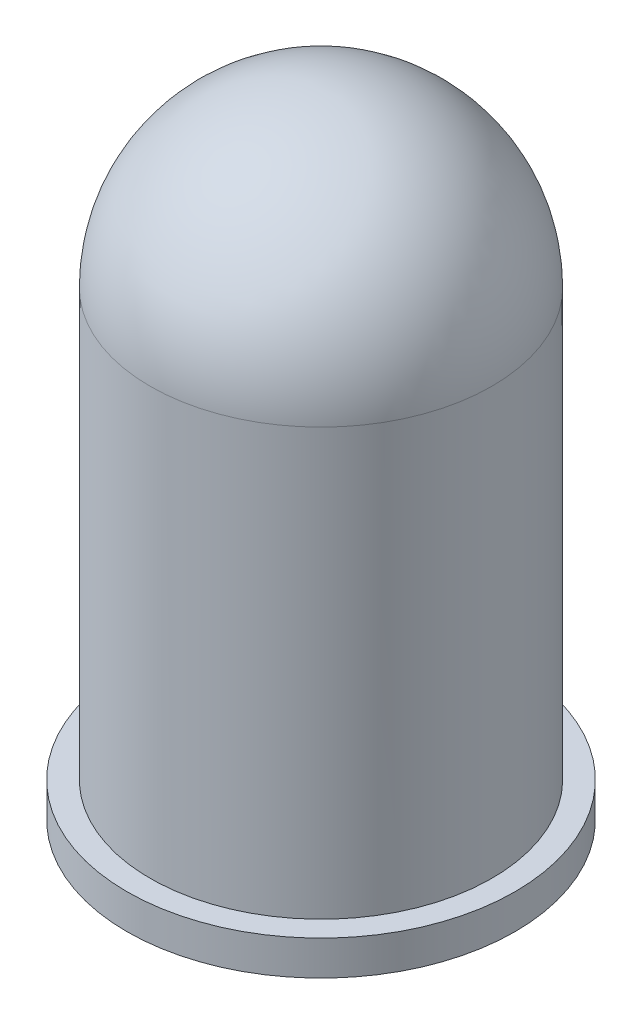
from build123d import *

# Parameters (mm, degrees)
SKETCH2_R           = 28
BOSS_EXTRUDE1_DEPTH = 5
SKETCH3_W           = 5
SKETCH3_H           = 20
CUT_EXTRUDE1_DEPTH  = 10


with BuildPart() as part:
    # Sketch1 → Revolve1 (revolve)
    with BuildSketch(Plane.XY):
        with BuildLine():
            Line((-24.662024669, 18.27739706), (-24.662024669, -43.219960911))
            Line((-24.662024669, -43.219960911), (0, -43.219960911))
            Line((0, -43.219960911), (0, 42.939421729))
            ThreePointArc((0, 42.939421729), (-17.438684882, 35.716081941), (-24.662024669, 18.27739706))
        make_face()
    revolve(axis=Axis((0, -43.219960911, 0), (0, 1, 0)))

    # Sketch2 → Boss-Extrude1 (add)
    with BuildSketch(Plane.XZ.offset(43.219960911)):
        with Locations(Location((0, 0, 0), (0, 0, 270))):
            Circle(SKETCH2_R)
    extrude(amount=BOSS_EXTRUDE1_DEPTH)

    # Sketch3 → Cut-Extrude1 (cut)
    with BuildSketch(Plane.XZ.offset(48.219960911)):
        Rectangle(SKETCH3_W, SKETCH3_H)
    extrude(amount=-CUT_EXTRUDE1_DEPTH, mode=Mode.SUBTRACT)


solid = part.part
